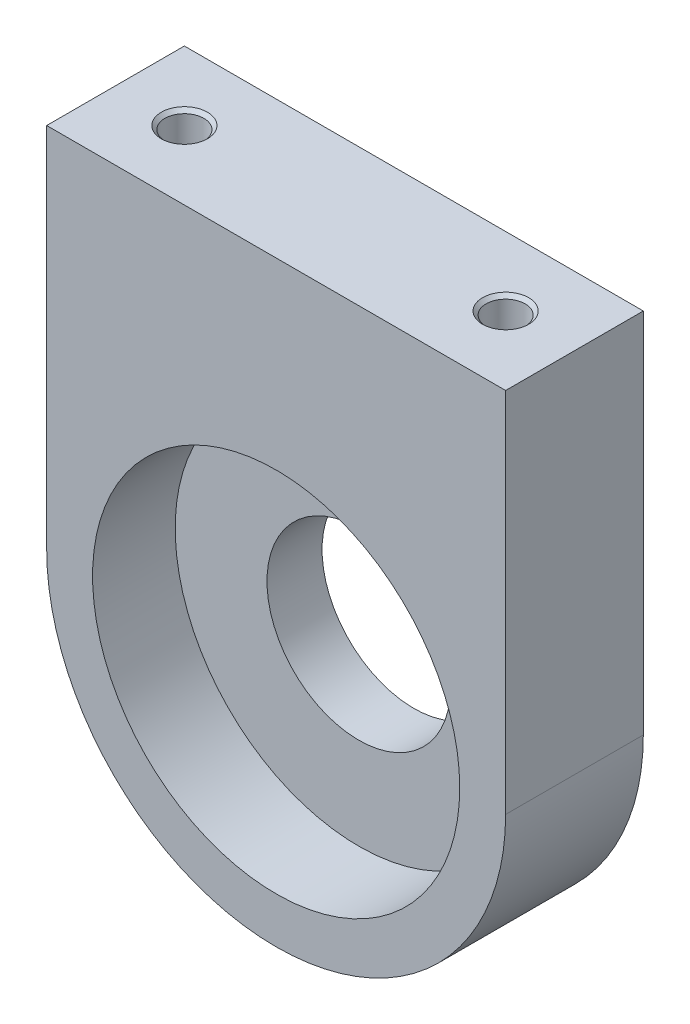
from build123d import *

# Parameters (mm, degrees)
BOSS_EXTRUDE1_DEPTH          = 15
SKETCH4_R                    = 20
CUT_EXTRUDE1_DEPTH           = 30
SKETCH5_R                    = 40
CUT_EXTRUDE2_DEPTH           = 18
M10_TAPPED_HOLE1_D           = 8.5
M10_TAPPED_HOLE1_DEPTH       = 24.5
M10_TAPPED_HOLE1_CSINK_D     = 10.05
M10_TAPPED_HOLE1_CSINK_ANGLE = 90
M10_TAPPED_HOLE1_TIP         = 2.553657631


with BuildPart() as part:
    # Sketch2 → Boss-Extrude1 (new, symmetric)
    with BuildSketch(Plane.XY):
        with BuildLine():
            Line((-50, 0), (-50, 80))
            Line((-50, 80), (50, 80))
            Line((50, 80), (50, 0))
            ThreePointArc((50, 0), (0, -50), (-50, 0))
        make_face()
    extrude(amount=BOSS_EXTRUDE1_DEPTH, both=True)

    # Sketch4 → Cut-Extrude1 (cut)
    with BuildSketch(Plane.XY.offset(15)):
        Circle(SKETCH4_R)
    extrude(amount=-CUT_EXTRUDE1_DEPTH, mode=Mode.SUBTRACT)

    # Sketch5 → Cut-Extrude2 (cut)
    with BuildSketch(Plane.XY.offset(15)):
        Circle(SKETCH5_R)
    extrude(amount=-CUT_EXTRUDE2_DEPTH, mode=Mode.SUBTRACT)

    # M10 Tapped Hole1
    with Locations(Plane(origin=(-35, 80, 0), x_dir=(0, 0, 1), z_dir=(0, 1, 0))):
        with Locations((0, 0), (0, 70)):
            CounterSinkHole(M10_TAPPED_HOLE1_D / 2, M10_TAPPED_HOLE1_CSINK_D / 2, depth=M10_TAPPED_HOLE1_DEPTH, counter_sink_angle=M10_TAPPED_HOLE1_CSINK_ANGLE)
            with Locations((0, 0, -(M10_TAPPED_HOLE1_DEPTH + M10_TAPPED_HOLE1_TIP / 2))):  # 118° drill point
                Cone(0, M10_TAPPED_HOLE1_D / 2, M10_TAPPED_HOLE1_TIP, mode=Mode.SUBTRACT)


solid = part.part
